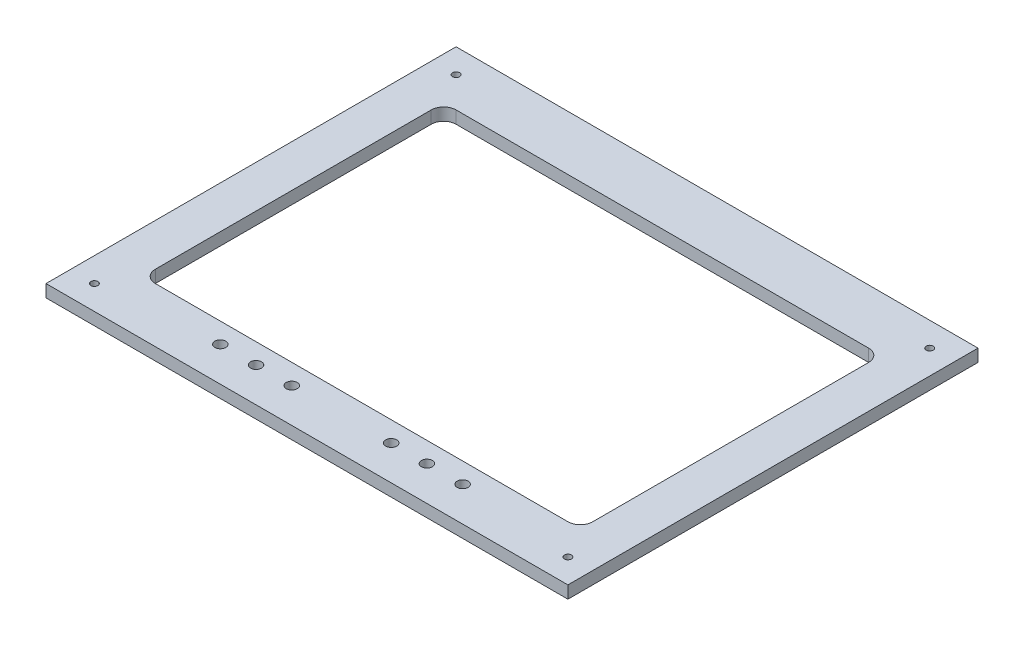
from build123d import *

# Parameters (mm, degrees)
SKETCH1_W              = 266.7
SKETCH1_H              = 209.55
BOSS_EXTRUDE1_DEPTH    = 6.35
M3_CLEARANCE_HOLE1_D   = 3.6
SKETCH4_W              = 223.52
SKETCH4_H              = 153.67
CUT_EXTRUDE1_DEPTH     = 170.706645789
F_10_CLEARANCE_HOLE1_D = 5.6134
FILLET1_R              = 6.35


with BuildPart() as part:
    # Sketch1 → Boss-Extrude1 (new body)
    with BuildSketch(Plane(origin=(0, 0, 0), x_dir=(1, 0, 0), z_dir=(0, 1, 0))):
        Rectangle(SKETCH1_W, SKETCH1_H)
    extrude(amount=BOSS_EXTRUDE1_DEPTH)

    # M3 Clearance Hole1 (through all)
    with Locations(Plane(origin=(0, 6.35, 0), x_dir=(1, 0, 0), z_dir=(0, 1, 0))):
        with Locations((121.0056, -92.4306), (-121.0056, -92.4306), (-121.0056, 92.4306), (121.0056, 92.4306)):
            Hole(M3_CLEARANCE_HOLE1_D / 2)

    # Sketch4 → Cut-Extrude1 (cut, through all)
    with BuildSketch(Plane(origin=(0, 6.35, 0), x_dir=(1, 0, 0), z_dir=(0, 1, 0))):
        Rectangle(SKETCH4_W, SKETCH4_H)
    extrude(amount=-CUT_EXTRUDE1_DEPTH, mode=Mode.SUBTRACT)

    # #10 Clearance Hole1 (through all)
    with Locations(Plane(origin=(0, 6.35, 0), x_dir=(1, 0, 0), z_dir=(0, 1, 0))):
        with Locations((-61.9125, -87.1474), (-43.65625, -87.1474), (-25.4, -87.1474), (25.4, -87.1474), (43.65625, -87.1474), (61.9125, -87.1474)):
            Hole(F_10_CLEARANCE_HOLE1_D / 2)

    # Fillet1
    fillet1_edges = [part.edges().sort_by_distance(p)[0] for p in [
        (-111.76, 3.175, 76.835),
        (-111.76, 3.175, -76.835),
        (111.76, 3.175, -76.835),
        (111.76, 3.175, 76.835),
    ]]
    fillet(fillet1_edges, radius=FILLET1_R)


solid = part.part
